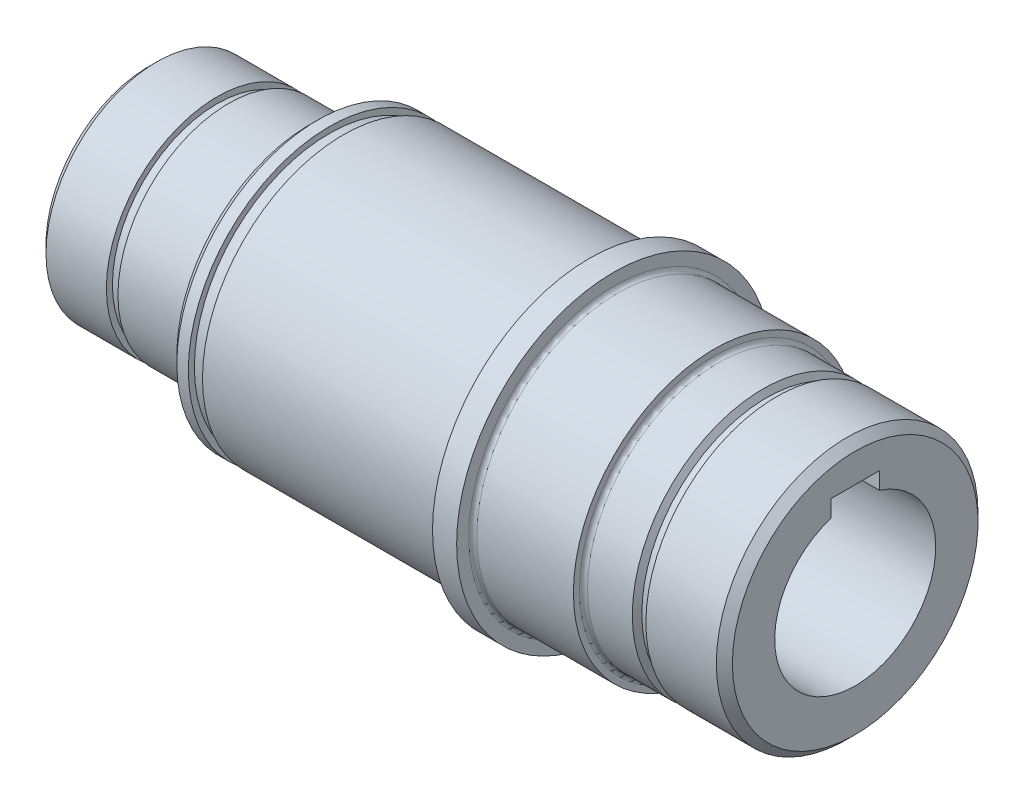
from build123d import *

# Parameters (mm, degrees)
SCHIZZO2_R               = 20
TAGLIO_ESTRUSIONE1_DEPTH = 184.962632075
SMUSSO1_SIZE             = 2
RACCORDO1_R              = 1
TAGLIO_ESTRUSIONE2_START = -35
TAGLIO_ESTRUSIONE2_DEPTH = 5


with BuildPart() as part:
    # Schizzo1 → Rivoluzione1 (revolve)
    with BuildSketch(Plane.XY, mode=Mode.PRIVATE) as rivoluzione1_sk:
        Polygon((0, 0), (0, 27.5), (17, 27.5), (17, 26), (19, 26), (19.866025404, 27.5), (40, 27.5), (40, 35), (109.5, 35), (109.5, 39), (115.5, 39), (115.5, 35), (140.5, 35), (140.5, 32.5), (152.633974596, 32.5), (153.5, 31), (156, 31), (156, 32.5), (175.5, 32.5), (175.5, 0), align=None)
    revolve(rivoluzione1_sk.sketch.rotate(Axis((0, 0, 0), (1, 0, 0)), 90), axis=Axis((0, 0, 0), (1, 0, 0)))

    # Schizzo2 → Taglio-Estrusione1 (cut, through all)
    with BuildSketch(Plane.ZY):
        with BuildLine():
            ThreePointArc((-6, 19.078784028), (-3.035153986, 19.768354516), (0, 20))
            Line((0, 20), (0, 23.3))
            Line((0, 23.3), (-6, 23.3))
            Line((-6, 23.3), (-6, 19.078784028))
        make_face()
        with BuildLine():
            Line((0, 23.3), (0, 20))
            ThreePointArc((0, 20), (3.035153986, 19.768354516), (6, 19.078784028))
            Line((6, 19.078784028), (6, 23.3))
            Line((6, 23.3), (0, 23.3))
        make_face()
        Circle(SCHIZZO2_R)
    extrude(amount=-TAGLIO_ESTRUSIONE1_DEPTH, mode=Mode.SUBTRACT)

    # Smusso1
    smusso1_edges = [part.edges().sort_by_distance(p)[0] for p in [
        (175.5, 0, -32.5),
        (40, 0, -35),
        (0, 0, -27.5),
    ]]
    chamfer(smusso1_edges, length=SMUSSO1_SIZE)

    # Raccordo1
    raccordo1_edges = [part.edges().sort_by_distance(p)[0] for p in [
        (140.5, 0, -32.5),
        (115.5, 0, -35),
        (109.5, 0, -35),
    ]]
    fillet(raccordo1_edges, radius=RACCORDO1_R)

    # Schizzo3 → Taglia-Rivoluzione1 (revolve, cut)
    with BuildSketch(Plane.XY, mode=Mode.PRIVATE) as taglia_rivoluzione1_sk:
        Polygon((48.366025404, 35), (47.5, 33.5), (44.85, 33.5), (44.85, 35), align=None)
    revolve(taglia_rivoluzione1_sk.sketch.rotate(Axis((-16.412152114, 0, 0), (1, 0, 0)), 90), axis=Axis((-16.412152114, 0, 0), (1, 0, 0)), mode=Mode.SUBTRACT)

    # Schizzo4 → Taglio-Estrusione2 (cut)
    with BuildSketch(Plane(origin=(0, 0, 0), x_dir=(1, 0, 0), z_dir=(0, 1, 0)).offset(TAGLIO_ESTRUSIONE2_START)):
        with BuildLine():
            Line((60.5, 10), (96.5, 10))
            ThreePointArc((96.5, 10), (106.5, 0), (96.5, -10))
            Line((96.5, -10), (60.5, -10))
            ThreePointArc((60.5, -10), (50.5, 0), (60.5, 10))
        make_face()
    extrude(amount=TAGLIO_ESTRUSIONE2_DEPTH, mode=Mode.SUBTRACT)


solid = part.part
